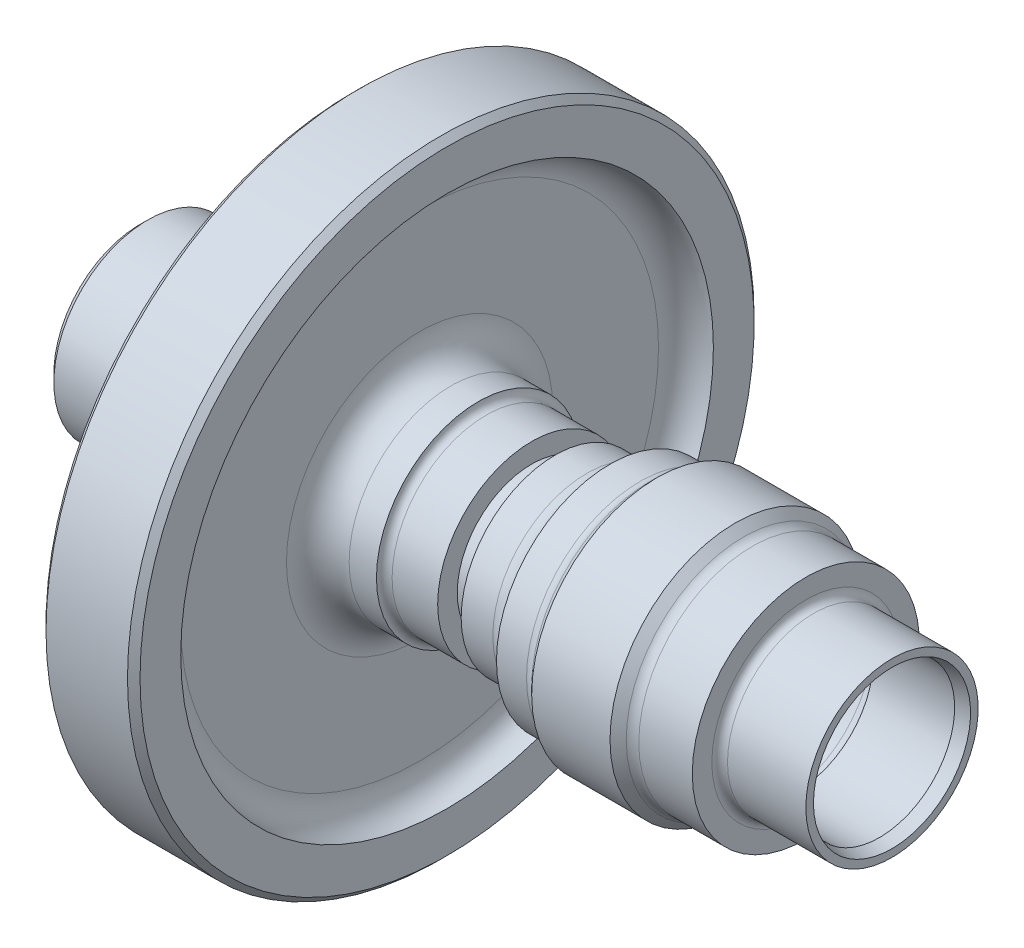
from build123d import *

# Parameters (mm, degrees)
SKETCH2_W = 165.1
SKETCH2_H = 69.85


with BuildPart() as part:
    # Sketch2 → Stock (revolve)
    with BuildSketch(Plane.XY, mode=Mode.PRIVATE) as stock_sk:
        with Locations((76.2, 34.925)):
            Rectangle(SKETCH2_W, SKETCH2_H)
    revolve(stock_sk.sketch.rotate(Axis((-19.925556777, 0, 0), (1, 0, 0)), 90), axis=Axis((-19.925556777, 0, 0), (1, 0, 0)))

    # Sketch3 → Cut-Revolve1 (revolve, cut)
    with BuildSketch(Plane.XY, mode=Mode.PRIVATE) as cut_revolve1_sk:
        with BuildLine():
            Line((67.1973878, 66.070896877), (153.302004357, 66.070896877))
            Line((153.302004357, 66.070896877), (154.572004357, 64.800896877))
            Line((154.572004357, 64.800896877), (154.572004357, 0))
            Line((154.572004357, 0), (158.75, 0))
            Line((158.75, 0), (158.75, 69.85))
            Line((158.75, 69.85), (66.3083878, 69.85))
            Line((66.3083878, 69.85), (66.3083878, 66.959896877))
            ThreePointArc((66.3083878, 66.959896877), (66.568769871, 66.331278949), (67.1973878, 66.070896877))
        make_face()
    revolve(cut_revolve1_sk.sketch.rotate(Axis((-15.107189542, 0, 0), (1, 0, 0)), 90), axis=Axis((-15.107189542, 0, 0), (1, 0, 0)), mode=Mode.SUBTRACT)

    # Sketch4 → Cut-Revolve3 (revolve, cut)
    with BuildSketch(Plane.XY, mode=Mode.PRIVATE) as cut_revolve3_sk:
        with BuildLine():
            Line((44.45, 63.5), (69.558204357, 63.5))
            ThreePointArc((69.558204357, 63.5), (70.186822286, 63.760382072), (70.447204357, 64.389))
            Line((70.447204357, 64.389), (70.447204357, 66.070896877))
            Line((70.447204357, 66.070896877), (67.1973878, 66.070896877))
            ThreePointArc((67.1973878, 66.070896877), (66.568769871, 66.331278949), (66.3083878, 66.959896877))
            Line((66.3083878, 66.959896877), (66.3083878, 69.85))
            Line((66.3083878, 69.85), (-6.35, 69.85))
            Line((-6.35, 69.85), (-6.35, 0))
            Line((-6.35, 0), (115.103996745, 0))
            Line((115.103996745, 0), (107.95, 11.90625))
            Line((107.95, 11.90625), (26.67, 11.90625))
            Line((26.67, 11.90625), (25.4, 13.17625))
            Line((25.4, 13.17625), (25.4, 15.08125))
            ThreePointArc((25.4, 15.08125), (24.936891887, 16.199291887), (23.81885, 16.6624))
            Line((23.81885, 16.6624), (14.167482909, 16.6624))
            ThreePointArc((14.167482909, 16.6624), (12.391352036, 17.614090251), (11.1125, 16.056883558))
            Line((11.1125, 16.056883558), (11.1125, 15.875))
            Line((11.1125, 15.875), (2.962315329, 15.875))
            ThreePointArc((2.962315329, 15.875), (2.168565329, 15.662315329), (1.5875, 15.08125))
            Line((1.5875, 15.08125), (0, 15.08125))
            Line((0, 15.08125), (0, 17.4625))
            Line((0, 17.4625), (1.5875, 19.05))
            Line((1.5875, 19.05), (16.1925, 19.05))
            ThreePointArc((16.1925, 19.05), (17.315032015, 19.514967985), (17.78, 20.6375))
            Line((17.78, 20.6375), (17.78, 25.4))
            Line((17.78, 25.4), (21.278531992, 25.4))
            ThreePointArc((21.278531992, 25.4), (22.673435947, 22.032403955), (26.041031992, 20.6375))
            Line((26.041031992, 20.6375), (42.3926, 20.6375))
            ThreePointArc((42.3926, 20.6375), (46.882728061, 22.497371939), (48.7426, 26.9875))
            Line((48.7426, 26.9875), (48.7426, 48.4124))
            ThreePointArc((48.7426, 48.4124), (47.113352181, 52.345752181), (43.18, 53.975))
            Line((43.18, 53.975), (43.18, 62.23))
            Line((43.18, 62.23), (44.45, 63.5))
        make_face()
    revolve(cut_revolve3_sk.sketch.rotate(Axis((171.840617082, 0, 0), (-1, 0, 0)), 90), axis=Axis((171.840617082, 0, 0), (-1, 0, 0)), mode=Mode.SUBTRACT)

    # Sketch5 → Cut-Revolve4 (revolve, cut)
    with BuildSketch(Plane.XY, mode=Mode.PRIVATE) as cut_revolve4_sk:
        with BuildLine():
            Line((101.6, 13.97), (101.6, 11.90625))
            Line((101.6, 11.90625), (107.95, 11.90625))
            Line((107.95, 11.90625), (115.103996745, 0))
            Line((115.103996745, 0), (154.572004357, 0))
            Line((154.572004357, 0), (154.572004357, 64.800896877))
            Line((154.572004357, 64.800896877), (153.302004357, 66.070896877))
            Line((153.302004357, 66.070896877), (70.447204357, 66.070896877))
            Line((70.447204357, 66.070896877), (70.447204357, 64.389))
            ThreePointArc((70.447204357, 64.389), (70.186822286, 63.760382072), (69.558204357, 63.5))
            Line((69.558204357, 63.5), (60.96, 63.5))
            Line((60.96, 63.5), (62.23, 62.23))
            Line((62.23, 62.23), (62.23, 53.975))
            ThreePointArc((62.23, 53.975), (58.296647819, 52.345752181), (56.6674, 48.4124))
            Line((56.6674, 48.4124), (56.6674, 26.9875))
            ThreePointArc((56.6674, 26.9875), (58.527271939, 22.497371939), (63.0174, 20.6375))
            Line((63.0174, 20.6375), (68.553634832, 20.6375))
            ThreePointArc((68.553634832, 20.6375), (69.018602816, 19.514967985), (70.141134832, 19.05))
            Line((70.141134832, 19.05), (79.375, 19.05))
            Line((79.375, 19.05), (79.375, 15.08125))
            Line((79.375, 15.08125), (84.1375, 15.08125))
            Line((84.1375, 15.08125), (84.1375, 19.05))
            Line((84.1375, 19.05), (90.555189435, 19.05))
            ThreePointArc((90.555189435, 19.05), (93.626909637, 20.17300261), (95.25, 23.0124))
            Line((95.25, 23.0124), (101.335297552, 23.0124))
            ThreePointArc((101.335297552, 23.0124), (102.30731347, 23.205745987), (103.131348776, 23.756348776))
            Line((103.131348776, 23.756348776), (104.775, 25.4))
            Line((104.775, 25.4), (120.65, 25.4))
            Line((120.65, 25.4), (122.293651224, 23.756348776))
            ThreePointArc((122.293651224, 23.756348776), (123.11768653, 23.205745987), (124.089702448, 23.0124))
            Line((124.089702448, 23.0124), (134.9375, 23.0124))
            Line((134.9375, 23.0124), (134.9375, 19.05))
            ThreePointArc((134.9375, 19.05), (135.402467985, 17.927467985), (136.525, 17.4625))
            Line((136.525, 17.4625), (152.4, 17.4625))
            Line((152.4, 17.4625), (152.4, 15.920590949))
            Line((152.4, 15.920590949), (149.86, 15.24))
            Line((149.86, 15.24), (133.35, 15.24))
            ThreePointArc((133.35, 15.24), (132.234076836, 17.934076836), (129.54, 19.05))
            Line((129.54, 19.05), (106.68, 19.05))
            ThreePointArc((106.68, 19.05), (103.087897552, 17.562102448), (101.6, 13.97))
        make_face()
    revolve(cut_revolve4_sk.sketch.rotate(Axis((-11.813849318, 0, 0), (1, 0, 0)), 90), axis=Axis((-11.813849318, 0, 0), (1, 0, 0)), mode=Mode.SUBTRACT)


solid = part.part
